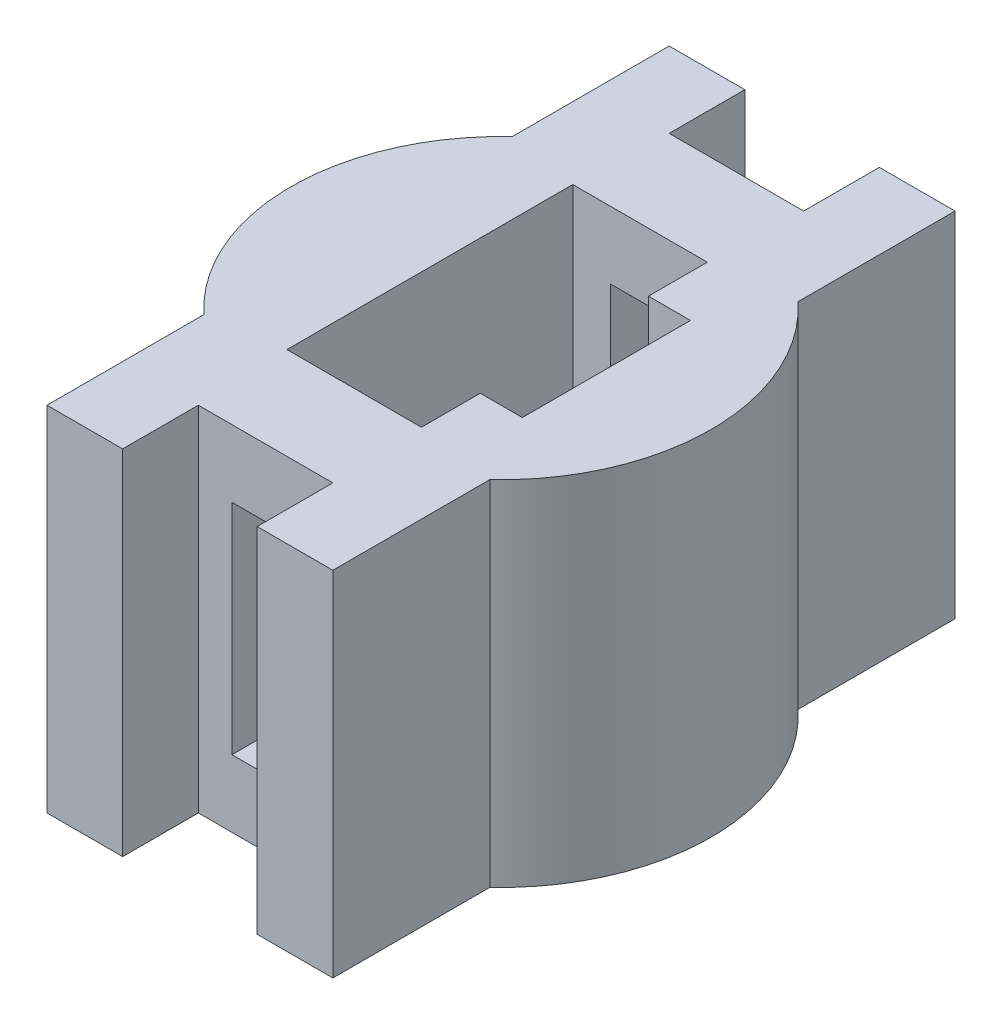
from build123d import *

# Parameters (mm, degrees)
SKETCH1_W           = 34
SKETCH1_H           = 42
BOSS_EXTRUDE1_DEPTH = 37
CUT_EXTRUDE1_DEPTH  = 9
CUT_EXTRUDE2_DEPTH  = 9
SKETCH9_R           = 25
BOSS_EXTRUDE3_DEPTH = 42
SKETCH10_W          = 16
SKETCH10_H          = 34
CUT_EXTRUDE5_DEPTH  = 70.978568148
CUT_EXTRUDE6_DEPTH  = 5
SKETCH13_W          = 8
SKETCH13_H          = 26
CUT_EXTRUDE7_DEPTH  = 89.051121515


with BuildPart() as part:
    # Sketch1 → Boss-Extrude1 (new, symmetric)
    with BuildSketch(Plane.XY):
        with Locations((17, 21)):
            Rectangle(SKETCH1_W, SKETCH1_H)
    extrude(amount=BOSS_EXTRUDE1_DEPTH, both=True)

    # Sketch2 → Cut-Extrude1 (cut)
    with BuildSketch(Plane.XY.offset(37)):
        Polygon((17, 42), (9, 42), (9, 0), (17, 0), (25, 0), (25, 42), align=None)
    extrude(amount=-CUT_EXTRUDE1_DEPTH, mode=Mode.SUBTRACT)

    # Sketch3 → Cut-Extrude2 (cut)
    with BuildSketch(Plane(origin=(0, 0, -37), x_dir=(-1, 0, 0), z_dir=(0, 0, -1))):
        Polygon((-17, 42), (-25, 42), (-25, 0), (-17, 0), (-9, 0), (-9, 42), align=None)
    extrude(amount=-CUT_EXTRUDE2_DEPTH, mode=Mode.SUBTRACT)

    # Sketch9 → Boss-Extrude3 (add, through all)
    with BuildSketch(Plane(origin=(0, 0, 0), x_dir=(1, 0, 0), z_dir=(0, 1, 0))):
        with Locations((17, 0)):
            Circle(SKETCH9_R)
    extrude(amount=BOSS_EXTRUDE3_DEPTH)

    # Sketch10 → Cut-Extrude5 (cut, through all)
    with BuildSketch(Plane(origin=(0, 42, 0), x_dir=(1, 0, 0), z_dir=(0, 1, 0))):
        with Locations((16.53776174, 0)):
            Rectangle(SKETCH10_W, SKETCH10_H)
    extrude(amount=-CUT_EXTRUDE5_DEPTH, mode=Mode.SUBTRACT)

    # Sketch11 → Cut-Extrude6 (cut)
    with BuildSketch(Plane.ZY.offset(-24.53776174)):
        Polygon((0, 42), (-10, 42), (-10, 32), (10, 32), (10, 42), align=None)
    extrude(amount=-CUT_EXTRUDE6_DEPTH, mode=Mode.SUBTRACT)

    # Sketch13 → Cut-Extrude7 (cut, through all)
    with BuildSketch(Plane(origin=(0, 0, -28), x_dir=(-1, 0, 0), z_dir=(0, 0, -1))):
        with Locations((-17, 21)):
            Rectangle(SKETCH13_W, SKETCH13_H)
    extrude(amount=-CUT_EXTRUDE7_DEPTH, mode=Mode.SUBTRACT)


solid = part.part
